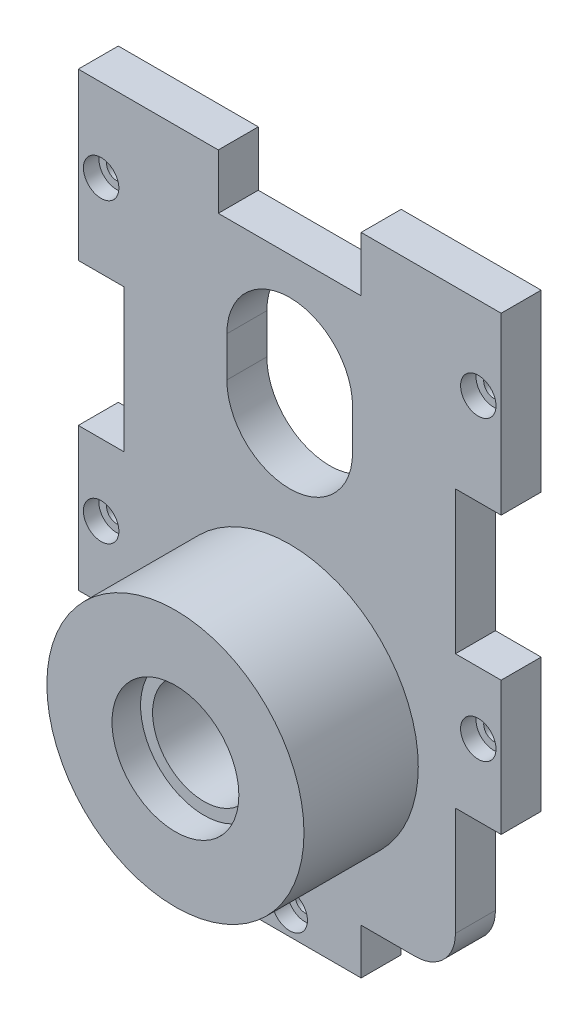
from build123d import *

# Parameters (mm, degrees)
CROQUIS2_R              = 22.5
SALIENTE_EXTRUIR1_DEPTH = 7
CROQUIS2_4_R            = 11.1
CROQUIS2_4_R_2          = 9
SALIENTE_EXTRUIR2_DEPTH = 22
CROQUIS2_5_R            = 22.5
CROQUIS2_5_R_2          = 11.1
SALIENTE_EXTRUIR3_DEPTH = 27
CROQUIS3_R              = 1.75
CORTAR_EXTRUIR1_DEPTH   = 7
CROQUIS4_R              = 3.1
CORTAR_EXTRUIR2_DEPTH   = 2.7


with BuildPart() as part:
    # Croquis2 → Saliente-Extruir1 (new body)
    with BuildSketch(Plane.XY):
        with BuildLine():
            Line((-30.786620614, 39.205288522), (-30.786620614, 48.816010109))
            Line((-30.786620614, 48.816010109), (-55.286620614, 48.816010109))
            Line((-55.286620614, 48.816010109), (-55.286620614, 19.816010109))
            Line((-55.286620614, 19.816010109), (-47.286620614, 19.816010109))
            Line((-47.286620614, 19.816010109), (-47.286620614, -5.183989891))
            Line((-47.286620614, -5.183989891), (-55.286620614, -5.183989891))
            Line((-55.286620614, -5.183989891), (-55.286620614, -30.183989891))
            Line((-55.286620614, -30.183989891), (-47.286620614, -30.183989891))
            Line((-47.286620614, -30.183989891), (-47.286620614, -49.183989891))
            ThreePointArc((-47.286620614, -49.183989891), (-45.236368082, -54.133737359), (-40.286620614, -56.183989891))
            Line((-40.286620614, -56.183989891), (-30.786620614, -56.183989891))
            Line((-30.786620614, -56.183989891), (-30.786620614, -64.183989891))
            Line((-30.786620614, -64.183989891), (-5.786620614, -64.183989891))
            Line((-5.786620614, -64.183989891), (-5.786620614, -56.183989891))
            Line((-5.786620614, -56.183989891), (3.713379386, -56.183989891))
            ThreePointArc((3.713379386, -56.183989891), (8.663126854, -54.133737359), (10.713379386, -49.183989891))
            Line((10.713379386, -49.183989891), (10.713379386, -30.183989891))
            Line((10.713379386, -30.183989891), (18.713379386, -30.183989891))
            Line((18.713379386, -30.183989891), (18.713379386, -6.794711478))
            Line((18.713379386, -6.794711478), (10.713379386, -6.794711478))
            Line((10.713379386, -6.794711478), (10.713379386, 18.205288522))
            Line((10.713379386, 18.205288522), (18.713379386, 18.205288522))
            Line((18.713379386, 18.205288522), (18.713379386, 48.816010109))
            Line((18.713379386, 48.816010109), (-5.786620614, 48.816010109))
            Line((-5.786620614, 48.816010109), (-5.786620614, 39.205288522))
            Line((-5.786620614, 39.205288522), (-30.786620614, 39.205288522))
        make_face()
        with BuildLine():
            ThreePointArc((-7.286620614, 14.705288522), (-18.286620614, 3.705288522), (-29.286620614, 14.705288522))
            Line((-29.286620614, 14.705288522), (-29.286620614, 21.705288522))
            ThreePointArc((-29.286620614, 21.705288522), (-18.286620614, 32.705288522), (-7.286620614, 21.705288522))
            Line((-7.286620614, 21.705288522), (-7.286620614, 14.705288522))
        make_face(mode=Mode.SUBTRACT)
        with Locations((-18.286620614, -27.183989891)):
            Circle(CROQUIS2_R, mode=Mode.SUBTRACT)
    extrude(amount=SALIENTE_EXTRUIR1_DEPTH)



with BuildPart() as body_2:
    # Croquis2<4> → Saliente-Extruir2 (new body)
    with BuildSketch(Plane.XY):
        with Locations((-18.286620614, -27.183989891)):
            Circle(CROQUIS2_4_R)
        with Locations((-18.286620614, -27.183989891)):
            Circle(CROQUIS2_4_R_2, mode=Mode.SUBTRACT)
    extrude(amount=SALIENTE_EXTRUIR2_DEPTH)


with BuildPart() as part_1:
    add(part.part)

    add(body_2.part)  # Saliente-Extruir3 merges body 2
    # Croquis2<5> → Saliente-Extruir3 (add)
    with BuildSketch(Plane.XY):
        with Locations((-18.286620614, -27.183989891)):
            Circle(CROQUIS2_5_R)
        with Locations((-18.286620614, -27.183989891)):
            Circle(CROQUIS2_5_R_2, mode=Mode.SUBTRACT)
    extrude(amount=SALIENTE_EXTRUIR3_DEPTH)

    # Croquis3 → Cortar-Extruir1 (cut)
    with BuildSketch(Plane.XY.offset(7)):
        with Locations((-51.286620614, 34.316010109)):
            Circle(CROQUIS3_R)
        with Locations((-51.286620614, -17.683989891)):
            Circle(CROQUIS3_R)
        with Locations((-18.286620614, -60.183989891)):
            Circle(CROQUIS3_R)
        with Locations((14.713379386, -17.683989891)):
            Circle(CROQUIS3_R)
        with Locations((14.713379386, 34.316010109)):
            Circle(CROQUIS3_R)
    extrude(amount=-CORTAR_EXTRUIR1_DEPTH, mode=Mode.SUBTRACT)

    # Croquis4 → Cortar-Extruir2 (cut)
    with BuildSketch(Plane.XY.offset(7)):
        with Locations((-51.286620614, -17.683989891)):
            Circle(CROQUIS4_R)
        with Locations((-51.286620614, 34.316010109)):
            Circle(CROQUIS4_R)
        with Locations((14.713379386, 34.316010109)):
            Circle(CROQUIS4_R)
        with Locations((14.713379386, -17.683989891)):
            Circle(CROQUIS4_R)
        with Locations((-18.286620614, -60.183989891)):
            Circle(CROQUIS4_R)
    extrude(amount=-CORTAR_EXTRUIR2_DEPTH, mode=Mode.SUBTRACT)


solid = part_1.part
